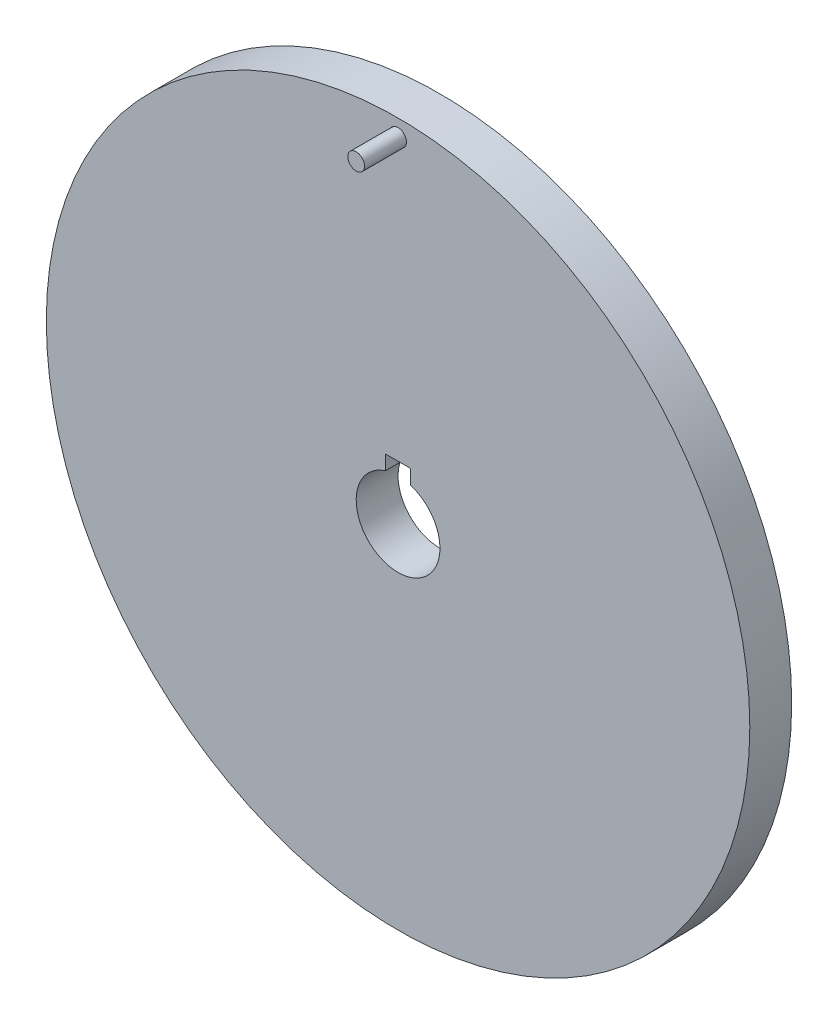
from build123d import *

# Parameters (mm, degrees)
SKETCH_2_R          = 42
SKETCH_2_R_2        = 1
EXTRUDE_1_DEPTH     = 5
SKETCH_3_R          = 1
EXTRUDE_2_DEPTH     = 5
SKETCH_4_R          = 5
CUT_EXTRUDE_1_DEPTH = 5
SKETCH_5_W          = 3
SKETCH_5_H          = 6.5
CUT_EXTRUDE_2_DEPTH = 5


with BuildPart() as part:
    # 草图2 → 凸台-拉伸1 (new body)
    # profile 1 of 2: a face of its own
    with BuildSketch(Plane.XY):
        Circle(SKETCH_2_R)
        with Locations((0, 40)):
            Circle(SKETCH_2_R_2, mode=Mode.SUBTRACT)
    # profile 2 of 2: a face of its own
    with BuildSketch(Plane.XY):
        with Locations((0, 40)):
            Circle(SKETCH_2_R_2)
    extrude(amount=EXTRUDE_1_DEPTH)

    # 草图3 → 凸台-拉伸2 (add)
    with BuildSketch(Plane.XY.offset(5)):
        with Locations((0, 40)):
            Circle(SKETCH_3_R)
    extrude(amount=EXTRUDE_2_DEPTH)

    # 草图4 → 切除-拉伸1 (cut)
    with BuildSketch(Plane.XY.offset(5)):
        Circle(SKETCH_4_R)
    extrude(amount=-CUT_EXTRUDE_1_DEPTH, mode=Mode.SUBTRACT)

    # 草图5 → 切除-拉伸2 (cut)
    with BuildSketch(Plane.XY.offset(5)):
        with Locations((0, 3.25)):
            Rectangle(SKETCH_5_W, SKETCH_5_H)
    extrude(amount=-CUT_EXTRUDE_2_DEPTH, mode=Mode.SUBTRACT)


solid = part.part
